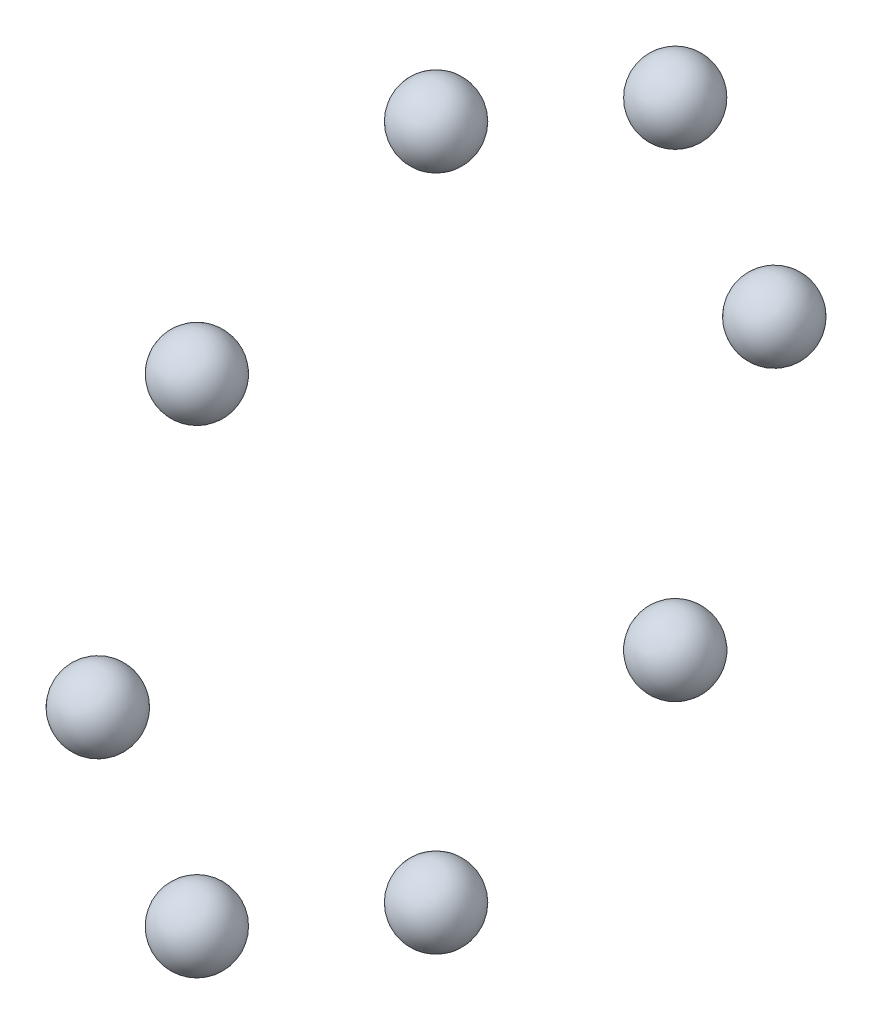
from build123d import *

# Parameters (mm, degrees)
CIRPATTERN1_COUNT = 8


with BuildPart() as part:
    # Sketch1 → Revolve1 (revolve)
    with BuildSketch(Plane.XY):
        with BuildLine():
            Line((0, 48.677340491), (0, 60.482659509))
            ThreePointArc((0, 60.482659509), (-5.902659509, 54.58), (0, 48.677340491))
        make_face()
    revolve(axis=Axis((0, 48.677340491, 0), (0, 1, 0)))


with BuildPart() as cirpattern1_1:
    # CirPattern1: pattern copy
    add(part.part.rotate(Axis((0, 0, 0), (1, 0, 0)), 1 * 360 / CIRPATTERN1_COUNT))


with BuildPart() as cirpattern1_2:
    # CirPattern1: pattern copy
    add(part.part.rotate(Axis((0, 0, 0), (1, 0, 0)), 2 * 360 / CIRPATTERN1_COUNT))


with BuildPart() as cirpattern1_3:
    # CirPattern1: pattern copy
    add(part.part.rotate(Axis((0, 0, 0), (1, 0, 0)), 3 * 360 / CIRPATTERN1_COUNT))


with BuildPart() as cirpattern1_4:
    # CirPattern1: pattern copy
    add(part.part.rotate(Axis((0, 0, 0), (1, 0, 0)), 4 * 360 / CIRPATTERN1_COUNT))


with BuildPart() as cirpattern1_5:
    # CirPattern1: pattern copy
    add(part.part.rotate(Axis((0, 0, 0), (1, 0, 0)), 5 * 360 / CIRPATTERN1_COUNT))


with BuildPart() as cirpattern1_6:
    # CirPattern1: pattern copy
    add(part.part.rotate(Axis((0, 0, 0), (1, 0, 0)), 6 * 360 / CIRPATTERN1_COUNT))


with BuildPart() as cirpattern1_7:
    # CirPattern1: pattern copy
    add(part.part.rotate(Axis((0, 0, 0), (1, 0, 0)), 7 * 360 / CIRPATTERN1_COUNT))


solid = Compound([part.part, cirpattern1_1.part, cirpattern1_2.part, cirpattern1_3.part, cirpattern1_4.part, cirpattern1_5.part, cirpattern1_6.part, cirpattern1_7.part])
